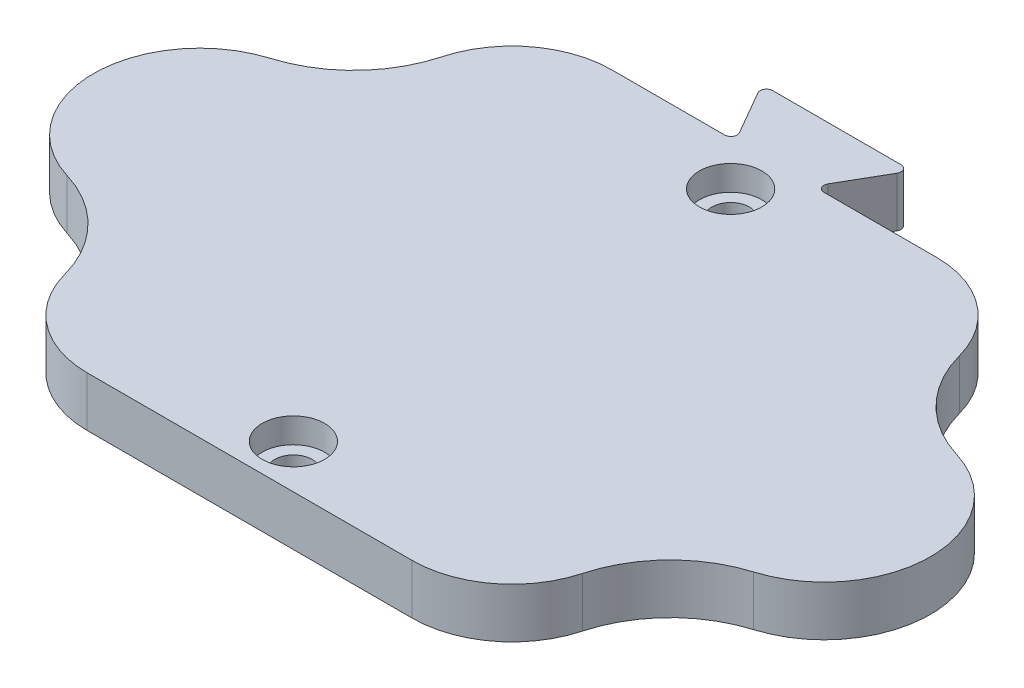
from build123d import *

# Parameters (mm, degrees)
SKETCH_1_W          = 100
SKETCH_1_H          = 100
EXTRUDE_1_DEPTH     = 4
SKETCH_4_W          = 100
SKETCH_4_H          = 100
CUT_EXTRUDE_1_DEPTH = 71.823724839
SKETCH_5_R          = 5.9
EXTRUDE_2_DEPTH     = 1
SKETCH_6_R          = 1.5
SKETCH_6_R_2        = 1
CUT_EXTRUDE_2_DEPTH = 43.699531613
SKETCH_7_R          = 2.5
CUT_EXTRUDE_3_DEPTH = 2


with BuildPart() as part:
    # Эскиз1 → Бобышка-Вытянуть1 (new body)
    with BuildSketch(Plane(origin=(0, 0, 0), x_dir=(1, 0, 0), z_dir=(0, 1, 0))):
        Rectangle(SKETCH_1_W, SKETCH_1_H)
    extrude(amount=EXTRUDE_1_DEPTH)

    # Эскиз4 → Вырез-Вытянуть1 (cut, through all)
    with BuildSketch(Plane(origin=(0, 4, 0), x_dir=(1, 0, 0), z_dir=(0, 1, 0))):
        Rectangle(SKETCH_4_W, SKETCH_4_H)
        with BuildLine():
            Line((3.546261356, 21.75), (5.566987298, 25.25))
            ThreePointArc((5.566987298, 25.25), (5.566987298, 25.75), (5.133974596, 26))
            Line((5.133974596, 26), (-5.133974596, 26))
            ThreePointArc((-5.133974596, 26), (-5.566987298, 25.75), (-5.566987298, 25.25))
            Line((-5.566987298, 25.25), (-3.546261356, 21.75))
            ThreePointArc((-3.546261356, 21.75), (-3.546261356, 21.25), (-3.979274058, 21))
            Line((-3.979274058, 21), (-13, 21))
            ThreePointArc((-13, 21), (-17.862198755, 19.352875197), (-20.722235468, 15.089755817))
            ThreePointArc((-20.722235468, 15.089755817), (-23.196926567, 10.739563503), (-27.469608288, 8.133328648))
            ThreePointArc((-27.469608288, 8.133328648), (-33.5, 0), (-27.469608288, -8.133328648))
            ThreePointArc((-27.469608288, -8.133328648), (-23.196926567, -10.739563503), (-20.722235468, -15.089755817))
            ThreePointArc((-20.722235468, -15.089755817), (-17.862198755, -19.352875197), (-13, -21))
            Line((-13, -21), (13, -21))
            ThreePointArc((13, -21), (17.862198755, -19.352875197), (20.722235468, -15.089755817))
            ThreePointArc((20.722235468, -15.089755817), (23.196926567, -10.739563503), (27.469608288, -8.133328648))
            ThreePointArc((27.469608288, -8.133328648), (33.5, 0), (27.469608288, 8.133328648))
            ThreePointArc((27.469608288, 8.133328648), (23.196926567, 10.739563503), (20.722235468, 15.089755817))
            ThreePointArc((20.722235468, 15.089755817), (17.862198755, 19.352875197), (13, 21))
            Line((13, 21), (3.979274058, 21))
            ThreePointArc((3.979274058, 21), (3.546261356, 21.25), (3.546261356, 21.75))
        make_face(mode=Mode.SUBTRACT)
    extrude(amount=-CUT_EXTRUDE_1_DEPTH, mode=Mode.SUBTRACT)

    # Эскиз5 → Бобышка-Вытянуть2 (add)
    with BuildSketch(Plane.XZ):
        with Locations(Location((25, 0, 0), (0, 0, 270))):
            Circle(SKETCH_5_R)
        with Locations(Location((-25, 0, 0), (0, 0, 270))):
            Circle(SKETCH_5_R)
        with BuildLine():
            Line((-0.970460198, 14.023475383), (0.970460198, 14.023475383))
            ThreePointArc((0.970460198, 14.023475383), (1.700884179, 14.199930228), (2.270199596, 14.690374372))
            ThreePointArc((2.270199596, 14.690374372), (15.793250353, 15.793250353), (14.690374372, 2.270199596))
            ThreePointArc((14.690374372, 2.270199596), (14.199930228, 1.700884179), (14.023475383, 0.970460198))
            Line((14.023475383, 0.970460198), (14.023475383, -0.970460198))
            ThreePointArc((14.023475383, -0.970460198), (14.199930228, -1.700884179), (14.690374372, -2.270199596))
            ThreePointArc((14.690374372, -2.270199596), (15.793250353, -15.793250353), (2.270199596, -14.690374372))
            ThreePointArc((2.270199596, -14.690374372), (1.700884179, -14.199930228), (0.970460198, -14.023475383))
            Line((0.970460198, -14.023475383), (-0.970460198, -14.023475383))
            ThreePointArc((-0.970460198, -14.023475383), (-1.700884179, -14.199930228), (-2.270199596, -14.690374372))
            ThreePointArc((-2.270199596, -14.690374372), (-15.793250353, -15.793250353), (-14.690374372, -2.270199596))
            ThreePointArc((-14.690374372, -2.270199596), (-14.199930228, -1.700884179), (-14.023475383, -0.970460198))
            Line((-14.023475383, -0.970460198), (-14.023475383, 0.970460198))
            ThreePointArc((-14.023475383, 0.970460198), (-14.199930228, 1.700884179), (-14.690374372, 2.270199596))
            ThreePointArc((-14.690374372, 2.270199596), (-15.793250353, 15.793250353), (-2.270199596, 14.690374372))
            ThreePointArc((-2.270199596, 14.690374372), (-1.700884179, 14.199930228), (-0.970460198, 14.023475383))
        make_face()
    extrude(amount=EXTRUDE_2_DEPTH)

    # Эскиз6 → Вырез-Вытянуть2 (cut, through all)
    # profile 1 of 4: a face of its own
    with BuildSketch(Plane(origin=(0, 4, 0), x_dir=(1, 0, 0), z_dir=(0, 1, 0))):
        with Locations(Location((0, 17.5, 0), (0, 0, 270))):
            Circle(SKETCH_6_R)
        with Locations((0, 17.5)):
            Circle(SKETCH_6_R_2, mode=Mode.SUBTRACT)
    # profile 2 of 4: a face of its own
    with BuildSketch(Plane(origin=(0, 4, 0), x_dir=(1, 0, 0), z_dir=(0, 1, 0))):
        with Locations((0, 17.5)):
            Circle(SKETCH_6_R_2)
    # profile 3 of 4: a face of its own
    with BuildSketch(Plane(origin=(0, 4, 0), x_dir=(1, 0, 0), z_dir=(0, 1, 0))):
        with Locations(Location((0, -17.5, 0), (0, 0, 270))):
            Circle(SKETCH_6_R)
        with Locations((0, -17.5)):
            Circle(SKETCH_6_R_2, mode=Mode.SUBTRACT)
    # profile 4 of 4: a face of its own
    with BuildSketch(Plane(origin=(0, 4, 0), x_dir=(1, 0, 0), z_dir=(0, 1, 0))):
        with Locations((0, -17.5)):
            Circle(SKETCH_6_R_2)
    extrude(amount=-CUT_EXTRUDE_2_DEPTH, mode=Mode.SUBTRACT)

    # Эскиз7 → Вырез-Вытянуть3 (cut)
    with BuildSketch(Plane(origin=(0, 4, 0), x_dir=(1, 0, 0), z_dir=(0, 1, 0))):
        with Locations(Location((0, 17.5, 0), (0, 0, 270))):
            Circle(SKETCH_7_R)
        with Locations(Location((0, -17.5, 0), (0, 0, 270))):
            Circle(SKETCH_7_R)
    extrude(amount=-CUT_EXTRUDE_3_DEPTH, mode=Mode.SUBTRACT)


solid = part.part
